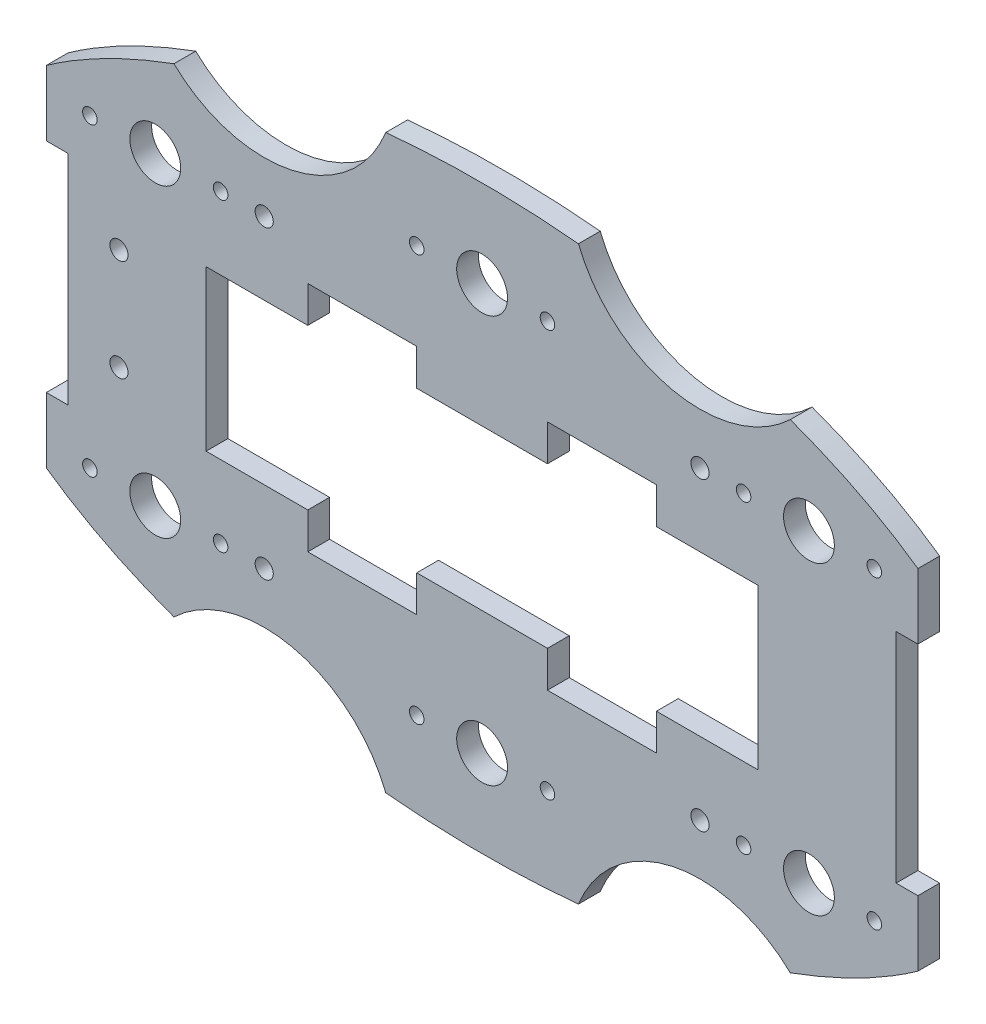
from build123d import *

# Parameters (mm, degrees)
SKETCH1_RX          = 75
SKETCH1_RY          = 40
SKETCH1_R           = 3.5
BOSS_EXTRUDE1_DEPTH = 3
SKETCH2_R           = 1.25
SKETCH2_R_2         = 18
CUT_EXTRUDE1_DEPTH  = 10
SKETCH4_R           = 1
CUT_EXTRUDE2_DEPTH  = 10
SKETCH9_R           = 1.25
CUT_EXTRUDE3_DEPTH  = 3


with BuildPart() as part:
    # Sketch1 → Boss-Extrude1 (new body)
    with BuildSketch(Plane.XY):
        with Locations((0, 0)):
            Ellipse(SKETCH1_RX, SKETCH1_RY)
        with Locations((0, 28)):
            Circle(SKETCH1_R, mode=Mode.SUBTRACT)
        with Locations((0, -28)):
            Circle(SKETCH1_R, mode=Mode.SUBTRACT)
        with Locations((45, 21)):
            Circle(SKETCH1_R, mode=Mode.SUBTRACT)
        with Locations((-45, 21)):
            Circle(SKETCH1_R, mode=Mode.SUBTRACT)
        with Locations((-45, -21)):
            Circle(SKETCH1_R, mode=Mode.SUBTRACT)
        with Locations((45, -21)):
            Circle(SKETCH1_R, mode=Mode.SUBTRACT)
    extrude(amount=BOSS_EXTRUDE1_DEPTH)

    # Sketch2 → Cut-Extrude1 (cut)
    with BuildSketch(Plane.XY.offset(3)):
        with Locations((-30, 21)):
            Circle(SKETCH2_R)
        with Locations((30, 21)):
            Circle(SKETCH2_R)
        with Locations((30, -21)):
            Circle(SKETCH2_R)
        with Locations((-30, -21)):
            Circle(SKETCH2_R)
        with Locations((30, 46)):
            Circle(SKETCH2_R_2)
        with Locations((-30, 46)):
            Circle(SKETCH2_R_2)
        with Locations((30, -46)):
            Circle(SKETCH2_R_2)
        with Locations((-30, -46)):
            Circle(SKETCH2_R_2)
        with BuildLine():
            Line((60, 24), (60, 15))
            Line((60, 15), (57, 15))
            Line((57, 15), (57, -15))
            Line((57, -15), (60, -15))
            Line((60, -15), (60, -24))
            add(Edge.make_bspline(
                [(60, -24), (93.75, 0), (60, 24)],
                knots=[5.639684198, 5.639684198, 5.639684198, 6.926686416, 6.926686416, 6.926686416], degree=2, weights=[1, 0.8, 1]))
        make_face()
        with BuildLine():
            Line((-60, 24), (-60, 15))
            Line((-60, 15), (-57, 15))
            Line((-57, 15), (-57, -15))
            Line((-57, -15), (-60, -15))
            Line((-60, -15), (-60, -24))
            add(Edge.make_bspline(
                [(-60, 24), (-93.75, 0), (-60, -24)],
                knots=[2.498091545, 2.498091545, 2.498091545, 3.785093762, 3.785093762, 3.785093762], degree=2, weights=[1, 0.8, 1]))
        make_face()
    extrude(amount=-CUT_EXTRUDE1_DEPTH, mode=Mode.SUBTRACT)

    # Sketch4 → Cut-Extrude2 (cut)
    with BuildSketch(Plane.XY.offset(3)):
        with Locations((9, 28)):
            Circle(SKETCH4_R)
        with Locations((-9, 28)):
            Circle(SKETCH4_R)
        with Locations((9, -28)):
            Circle(SKETCH4_R)
        with Locations((-9, -28)):
            Circle(SKETCH4_R)
        with Locations((54, 21)):
            Circle(SKETCH4_R)
        with Locations((36, 21)):
            Circle(SKETCH4_R)
        with Locations((54, -21)):
            Circle(SKETCH4_R)
        with Locations((36, -21)):
            Circle(SKETCH4_R)
        with Locations((-36, 21)):
            Circle(SKETCH4_R)
        with Locations((-54, 21)):
            Circle(SKETCH4_R)
        with Locations((-36, -21)):
            Circle(SKETCH4_R)
        with Locations((-54, -21)):
            Circle(SKETCH4_R)
        Polygon((-9, 11), (9, 11), (9, 16), (24, 16), (24, 11), (38, 11), (38, -11), (24, -11), (24, -16), (9, -16), (9, -11), (-9, -11), (-9, -16), (-24, -16), (-24, -11), (-38, -11), (-38, 11), (-24, 11), (-24, 16), (-9, 16), align=None)
    extrude(amount=-CUT_EXTRUDE2_DEPTH, mode=Mode.SUBTRACT)

    # Sketch9 → Cut-Extrude3 (cut)
    with BuildSketch(Plane(origin=(0, 0, 0), x_dir=(-1, 0, 0), z_dir=(0, 0, -1))):
        with Locations((50, 7)):
            Circle(SKETCH9_R)
        with Locations((50, -7)):
            Circle(SKETCH9_R)
    extrude(amount=-CUT_EXTRUDE3_DEPTH, mode=Mode.SUBTRACT)


solid = part.part
